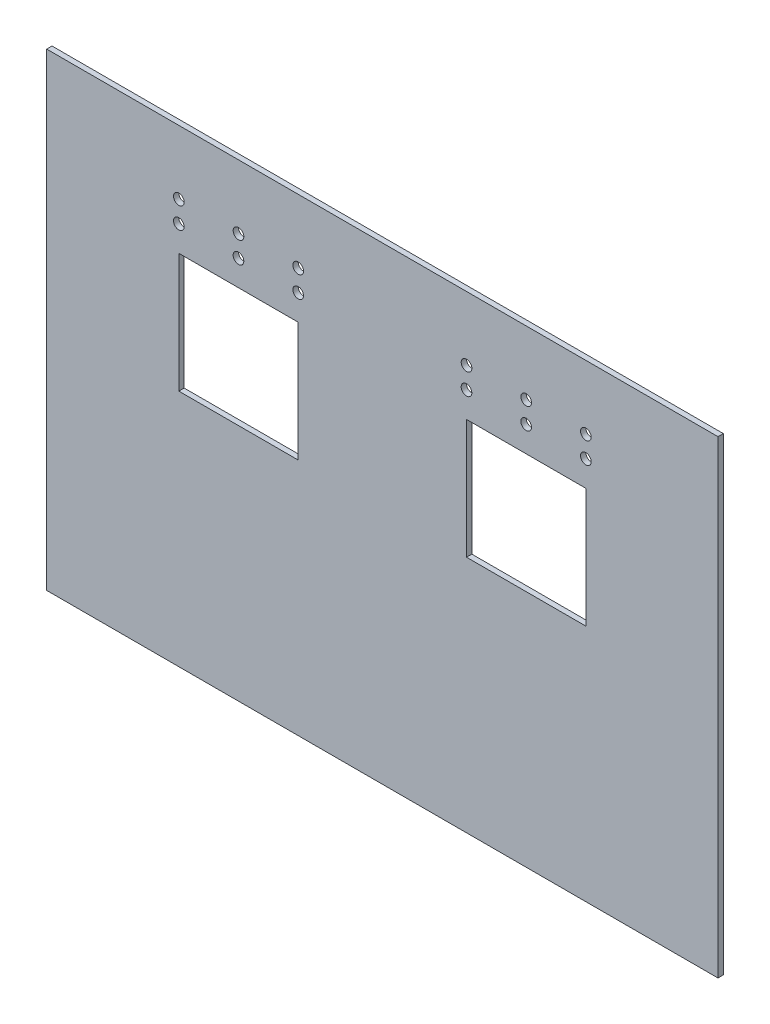
from build123d import *

# Parameters (mm, degrees)
SKETCH1_W           = 400.05
SKETCH1_H           = 279.4
SKETCH1_R           = 3.175
SKETCH1_W_2         = 71.12
SKETCH1_H_2         = 71.12
BOSS_EXTRUDE1_DEPTH = 3.175


with BuildPart() as part:
    # Sketch1 → Boss-Extrude1 (new body)
    with BuildSketch(Plane.XY):
        Rectangle(SKETCH1_W, SKETCH1_H)
        with Locations((-85.725, 88.9)):
            Circle(SKETCH1_R, mode=Mode.SUBTRACT)
        with Locations((-121.285, 88.9)):
            Circle(SKETCH1_R, mode=Mode.SUBTRACT)
        with Locations((-50.165, 88.9)):
            Circle(SKETCH1_R, mode=Mode.SUBTRACT)
        with Locations((-50.165, 101.6)):
            Circle(SKETCH1_R, mode=Mode.SUBTRACT)
        with Locations((-85.725, 101.6)):
            Circle(SKETCH1_R, mode=Mode.SUBTRACT)
        with Locations((-121.285, 101.6)):
            Circle(SKETCH1_R, mode=Mode.SUBTRACT)
        with Locations(Location((121.285, 88.9, 0), (0, 0, 180))):
            Circle(SKETCH1_R, mode=Mode.SUBTRACT)
        with Locations(Location((85.725, 88.9, 0), (0, 0, 180))):
            Circle(SKETCH1_R, mode=Mode.SUBTRACT)
        with Locations(Location((50.165, 88.9, 0), (0, 0, 180))):
            Circle(SKETCH1_R, mode=Mode.SUBTRACT)
        with Locations(Location((50.165, 101.6, 0), (0, 0, 180))):
            Circle(SKETCH1_R, mode=Mode.SUBTRACT)
        with Locations(Location((85.725, 101.6, 0), (0, 0, 180))):
            Circle(SKETCH1_R, mode=Mode.SUBTRACT)
        with Locations(Location((121.285, 101.6, 0), (0, 0, 180))):
            Circle(SKETCH1_R, mode=Mode.SUBTRACT)
        with Locations((-85.725, 38.1)):
            Rectangle(SKETCH1_W_2, SKETCH1_H_2, mode=Mode.SUBTRACT)
        with Locations((85.725, 38.1)):
            Rectangle(SKETCH1_W_2, SKETCH1_H_2, mode=Mode.SUBTRACT)
    extrude(amount=BOSS_EXTRUDE1_DEPTH)


solid = part.part
